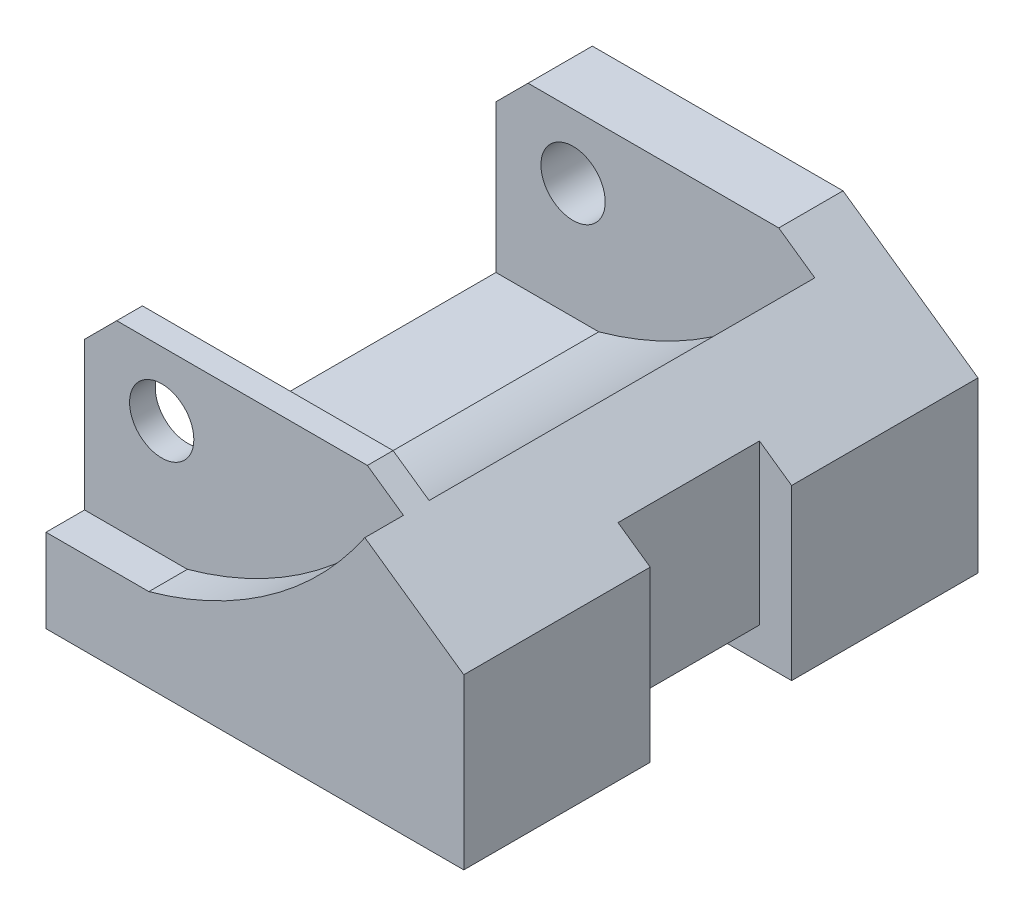
from build123d import *

# Parameters (mm, degrees)
SKETCH1_R           = 5
BOSS_EXTRUDE1_DEPTH = 40
CHAMFER1_SIZE       = 5
SKETCH3_R           = 5
CUT_EXTRUDE1_DEPTH  = 30
CUT_EXTRUDE2_START  = 34
SKETCH3_2_R         = 5
CUT_EXTRUDE2_DEPTH  = 6
SKETCH5_W           = 11
SKETCH5_H           = 9.012729091
SKETCH5_H_2         = 21.295641698
CUT_EXTRUDE3_DEPTH  = 5
SKETCH5_4_W         = 11
SKETCH5_4_H         = 5
CUT_EXTRUDE4_DEPTH  = 87.637174469


with BuildPart() as part:
    # Sketch1 → Boss-Extrude1 (new, symmetric)
    with BuildSketch(Plane.XY):
        Polygon((0, 0), (65, 0), (65, 26.295641698), (44, 41), (0, 41), align=None)
        with Locations((12, 31)):
            Circle(SKETCH1_R, mode=Mode.SUBTRACT)
    extrude(amount=BOSS_EXTRUDE1_DEPTH, both=True)

    # Chamfer1
    chamfer1_edges = [part.edges().sort_by_distance(p)[0] for p in [
        (0, 41, 0),
    ]]
    chamfer(chamfer1_edges, length=CHAMFER1_SIZE)

    # Sketch3 → Cut-Extrude1 (cut, symmetric)
    with BuildSketch(Plane.XY):
        with BuildLine():
            Line((0, 13), (16, 13))
            ThreePointArc((16, 13), (34.941864918, 22.051658235), (49.606003438, 37.074634133))
            Line((49.606003438, 37.074634133), (44, 41))
            Line((44, 41), (5, 41))
            Line((5, 41), (0, 36))
            Line((0, 36), (0, 13))
        make_face()
        with Locations((12, 31)):
            Circle(SKETCH3_R, mode=Mode.SUBTRACT)
    extrude(amount=CUT_EXTRUDE1_DEPTH, both=True, mode=Mode.SUBTRACT)

    # Sketch3<2> → Cut-Extrude2 (cut)
    with BuildSketch(Plane.XY.offset(CUT_EXTRUDE2_START)):
        with BuildLine():
            Line((0, 13), (16, 13))
            ThreePointArc((16, 13), (34.941864918, 22.051658235), (49.606003438, 37.074634133))
            Line((49.606003438, 37.074634133), (44, 41))
            Line((44, 41), (5, 41))
            Line((5, 41), (0, 36))
            Line((0, 36), (0, 13))
        make_face()
        with Locations((12, 31)):
            Circle(SKETCH3_2_R, mode=Mode.SUBTRACT)
    extrude(amount=CUT_EXTRUDE2_DEPTH, mode=Mode.SUBTRACT)

    # Sketch5 → Cut-Extrude3 (cut)
    with BuildSketch(Plane(origin=(65, 0, 0), x_dir=(0, 0, -1), z_dir=(1, 0, 0))):
        with Locations((5.5, 30.802006244)):
            Rectangle(SKETCH5_W, SKETCH5_H)
        with Locations((5.5, 15.647820849)):
            Rectangle(SKETCH5_W, SKETCH5_H_2)
        with Locations((-5.5, 30.802006244)):
            Rectangle(SKETCH5_W, SKETCH5_H)
        with Locations((-5.5, 15.647820849)):
            Rectangle(SKETCH5_W, SKETCH5_H_2)
    extrude(amount=-CUT_EXTRUDE3_DEPTH, mode=Mode.SUBTRACT)

    # Sketch5<4> → Cut-Extrude4 (cut, through all)
    with BuildSketch(Plane(origin=(65, 0, 0), x_dir=(0, 0, -1), z_dir=(1, 0, 0))):
        with Locations((5.5, 2.5)):
            Rectangle(SKETCH5_4_W, SKETCH5_4_H)
        with Locations((-5.5, 2.5)):
            Rectangle(SKETCH5_4_W, SKETCH5_4_H)
    extrude(amount=-CUT_EXTRUDE4_DEPTH, mode=Mode.SUBTRACT)


solid = part.part
